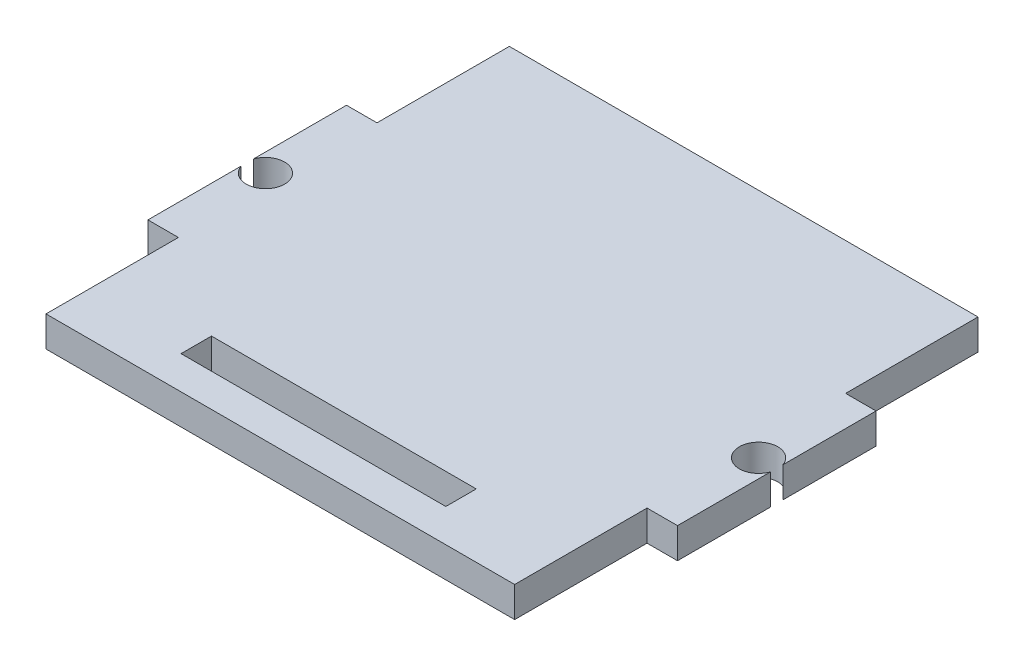
from build123d import *

# Parameters (mm, degrees)
SKETCH1_W           = 25.4
SKETCH1_H           = 2.921
BOSS_EXTRUDE1_DEPTH = 2.921


with BuildPart() as part:
    # Sketch1 → Boss-Extrude1 (new body)
    with BuildSketch(Plane(origin=(0, 0, 0), x_dir=(1, 0, 0), z_dir=(0, 1, 0))):
        with BuildLine():
            Line((2.921, 0), (47.879, 0))
            Line((47.879, 0), (47.879, 12.7))
            Line((47.879, 12.7), (50.8, 12.7))
            Line((50.8, 12.7), (50.8, 21.640420504))
            ThreePointArc((50.8, 21.640420504), (47.21225, 22.225), (50.8, 22.809579496))
            Line((50.8, 22.809579496), (50.8, 31.75))
            Line((50.8, 31.75), (47.879, 31.75))
            Line((47.879, 31.75), (47.879, 44.45))
            Line((47.879, 44.45), (2.921, 44.45))
            Line((2.921, 44.45), (2.921, 31.75))
            Line((2.921, 31.75), (0, 31.75))
            Line((0, 31.75), (0, 22.809579496))
            ThreePointArc((0, 22.809579496), (3.58775, 22.225), (0, 21.640420504))
            Line((0, 21.640420504), (0, 12.7))
            Line((0, 12.7), (2.921, 12.7))
            Line((2.921, 12.7), (2.921, 0))
        make_face()
        with Locations((25.4, 4.6355)):
            Rectangle(SKETCH1_W, SKETCH1_H, mode=Mode.SUBTRACT)
    extrude(amount=BOSS_EXTRUDE1_DEPTH)


solid = part.part
